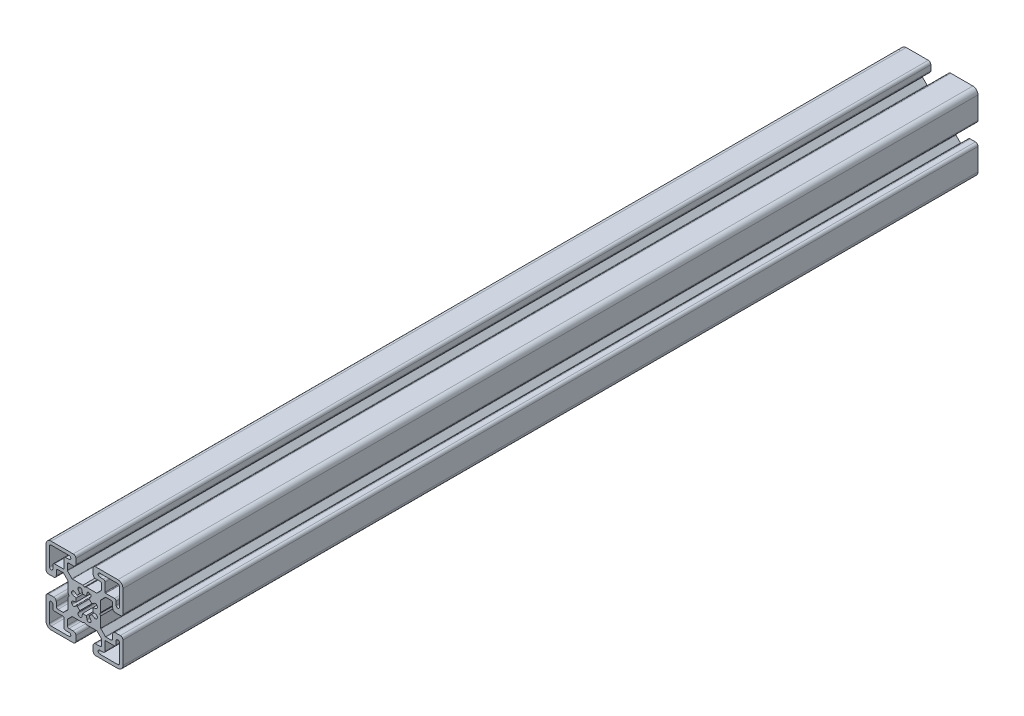
from build123d import *

# Parameters (mm, degrees)
EXTRUDE1_DEPTH = 500


with BuildPart() as part:
    # Sketch1 → Extrude1 (new body)
    with BuildSketch(Plane.XY):
        with BuildLine():
            Line((2.070696762, -5.483119356), (2.970696689, -4.967971313))
            Line((2.970696689, -4.967971313), (3.870696615, -5.483119356))
            Line((3.870696615, -5.483119356), (10.022269564, -5.483119356))
            ThreePointArc((10.022269564, -5.483119356), (10.167689268, -5.512045134), (10.290970141, -5.59441878))
            Line((10.290970141, -5.59441878), (12.909397265, -8.212845904))
            ThreePointArc((12.909397265, -8.212845904), (12.991770911, -8.336126777), (13.020696689, -8.481546481))
            Line((13.020696689, -8.481546481), (13.020696689, -11.483119356))
            ThreePointArc((13.020696689, -11.483119356), (12.72780347, -12.190226138), (12.020696689, -12.483119356))
            Line((12.020696689, -12.483119356), (9.555696689, -12.483119356))
            ThreePointArc((9.555696689, -12.483119356), (8.480894381, -12.928317049), (8.035696689, -14.003119356))
            Line((8.035696689, -14.003119356), (8.035696689, -16.963119356))
            ThreePointArc((8.035696689, -16.963119356), (8.480894381, -18.037921664), (9.555696689, -18.483119356))
            Line((9.555696689, -18.483119356), (22.470696689, -18.483119356))
            ThreePointArc((22.470696689, -18.483119356), (24.592017032, -17.6044397), (25.470696689, -15.483119356))
            Line((25.470696689, -15.483119356), (25.470696689, -2.568119356))
            ThreePointArc((25.470696689, -2.568119356), (25.025498996, -1.493317049), (23.950696689, -1.048119356))
            Line((23.950696689, -1.048119356), (20.990696689, -1.048119356))
            ThreePointArc((20.990696689, -1.048119356), (19.915894381, -1.493317049), (19.470696689, -2.568119356))
            Line((19.470696689, -2.568119356), (19.470696689, -5.033119356))
            ThreePointArc((19.470696689, -5.033119356), (19.17780347, -5.740226138), (18.470696689, -6.033119356))
            Line((18.470696689, -6.033119356), (15.469123813, -6.033119356))
            ThreePointArc((15.469123813, -6.033119356), (15.323704109, -6.004193579), (15.200423236, -5.921819933))
            Line((15.200423236, -5.921819933), (12.581996112, -3.303392809))
            ThreePointArc((12.581996112, -3.303392809), (12.499622466, -3.180111936), (12.470696689, -3.034692232))
            Line((12.470696689, -3.034692232), (12.470696689, 3.116881008))
            Line((12.470696689, 3.116881008), (11.951083419, 4.016880644))
            Line((11.951083419, 4.016880644), (12.470696689, 4.916880279))
            Line((12.470696689, 4.916880279), (12.470696689, 11.068453519))
            ThreePointArc((12.470696689, 11.068453519), (12.499622466, 11.213873223), (12.581996112, 11.337154096))
            Line((12.581996112, 11.337154096), (15.200423236, 13.95558122))
            ThreePointArc((15.200423236, 13.95558122), (15.323704109, 14.037954866), (15.469123813, 14.066880644))
            Line((15.469123813, 14.066880644), (18.470696689, 14.066880644))
            ThreePointArc((18.470696689, 14.066880644), (19.17780347, 13.773987425), (19.470696689, 13.066880644))
            Line((19.470696689, 13.066880644), (19.470696689, 10.601880644))
            ThreePointArc((19.470696689, 10.601880644), (19.915894381, 9.527078336), (20.990696689, 9.081880644))
            Line((20.990696689, 9.081880644), (23.950696689, 9.081880644))
            ThreePointArc((23.950696689, 9.081880644), (25.025498996, 9.527078336), (25.470696689, 10.601880644))
            Line((25.470696689, 10.601880644), (25.470696689, 23.516880644))
            ThreePointArc((25.470696689, 23.516880644), (24.592017032, 25.638200987), (22.470696689, 26.516880644))
            Line((22.470696689, 26.516880644), (9.555696689, 26.516880644))
            ThreePointArc((9.555696689, 26.516880644), (8.480894381, 26.071682951), (8.035696689, 24.996880644))
            Line((8.035696689, 24.996880644), (8.035696689, 22.036880644))
            ThreePointArc((8.035696689, 22.036880644), (8.480894381, 20.962078336), (9.555696689, 20.516880644))
            Line((9.555696689, 20.516880644), (12.020696689, 20.516880644))
            ThreePointArc((12.020696689, 20.516880644), (12.72780347, 20.223987425), (13.020696689, 19.516880644))
            Line((13.020696689, 19.516880644), (13.020696689, 16.515307768))
            ThreePointArc((13.020696689, 16.515307768), (12.991770911, 16.369888064), (12.909397265, 16.246607191))
            Line((12.909397265, 16.246607191), (10.290970141, 13.628180067))
            ThreePointArc((10.290970141, 13.628180067), (10.167689268, 13.545806421), (10.022269564, 13.516880644))
            Line((10.022269564, 13.516880644), (3.870696615, 13.516880644))
            Line((3.870696615, 13.516880644), (2.970696689, 13.0017326))
            Line((2.970696689, 13.0017326), (2.070696762, 13.516880644))
            Line((2.070696762, 13.516880644), (-4.080876187, 13.516880644))
            ThreePointArc((-4.080876187, 13.516880644), (-4.226295891, 13.545806421), (-4.349576764, 13.628180067))
            Line((-4.349576764, 13.628180067), (-6.968003888, 16.246607191))
            ThreePointArc((-6.968003888, 16.246607191), (-7.050377534, 16.369888064), (-7.079303311, 16.515307768))
            Line((-7.079303311, 16.515307768), (-7.079303311, 19.516880644))
            ThreePointArc((-7.079303311, 19.516880644), (-6.786410093, 20.223987425), (-6.079303311, 20.516880644))
            Line((-6.079303311, 20.516880644), (-3.614303311, 20.516880644))
            ThreePointArc((-3.614303311, 20.516880644), (-2.539501004, 20.962078336), (-2.094303311, 22.036880644))
            Line((-2.094303311, 22.036880644), (-2.094303311, 24.996880644))
            ThreePointArc((-2.094303311, 24.996880644), (-2.539501004, 26.071682951), (-3.614303311, 26.516880644))
            Line((-3.614303311, 26.516880644), (-16.529303311, 26.516880644))
            ThreePointArc((-16.529303311, 26.516880644), (-18.650623655, 25.638200987), (-19.529303311, 23.516880644))
            Line((-19.529303311, 23.516880644), (-19.529303311, 10.601880644))
            ThreePointArc((-19.529303311, 10.601880644), (-19.084105619, 9.527078336), (-18.009303311, 9.081880644))
            Line((-18.009303311, 9.081880644), (-15.049303311, 9.081880644))
            ThreePointArc((-15.049303311, 9.081880644), (-13.974501004, 9.527078336), (-13.529303311, 10.601880644))
            Line((-13.529303311, 10.601880644), (-13.529303311, 13.066880644))
            ThreePointArc((-13.529303311, 13.066880644), (-13.236410093, 13.773987425), (-12.529303311, 14.066880644))
            Line((-12.529303311, 14.066880644), (-9.527730436, 14.066880644))
            ThreePointArc((-9.527730436, 14.066880644), (-9.382310732, 14.037954866), (-9.259029859, 13.95558122))
            Line((-9.259029859, 13.95558122), (-6.640602735, 11.337154096))
            ThreePointArc((-6.640602735, 11.337154096), (-6.558229089, 11.213873223), (-6.529303311, 11.068453519))
            Line((-6.529303311, 11.068453519), (-6.529303311, 4.916880279))
            Line((-6.529303311, 4.916880279), (-6.009690042, 4.016880644))
            Line((-6.009690042, 4.016880644), (-6.529303311, 3.116881008))
            Line((-6.529303311, 3.116881008), (-6.529303311, -3.034692232))
            ThreePointArc((-6.529303311, -3.034692232), (-6.558229089, -3.180111936), (-6.640602735, -3.303392809))
            Line((-6.640602735, -3.303392809), (-9.259029859, -5.921819933))
            ThreePointArc((-9.259029859, -5.921819933), (-9.382310732, -6.004193579), (-9.527730436, -6.033119356))
            Line((-9.527730436, -6.033119356), (-12.529303311, -6.033119356))
            ThreePointArc((-12.529303311, -6.033119356), (-13.236410093, -5.740226138), (-13.529303311, -5.033119356))
            Line((-13.529303311, -5.033119356), (-13.529303311, -2.568119356))
            ThreePointArc((-13.529303311, -2.568119356), (-13.974501004, -1.493317049), (-15.049303311, -1.048119356))
            Line((-15.049303311, -1.048119356), (-18.009303311, -1.048119356))
            ThreePointArc((-18.009303311, -1.048119356), (-19.084105619, -1.493317049), (-19.529303311, -2.568119356))
            Line((-19.529303311, -2.568119356), (-19.529303311, -15.483119356))
            ThreePointArc((-19.529303311, -15.483119356), (-18.650623655, -17.6044397), (-16.529303311, -18.483119356))
            Line((-16.529303311, -18.483119356), (-3.614303311, -18.483119356))
            ThreePointArc((-3.614303311, -18.483119356), (-2.539501004, -18.037921664), (-2.094303311, -16.963119356))
            Line((-2.094303311, -16.963119356), (-2.094303311, -14.003119356))
            ThreePointArc((-2.094303311, -14.003119356), (-2.539501004, -12.928317049), (-3.614303311, -12.483119356))
            Line((-3.614303311, -12.483119356), (-6.079303311, -12.483119356))
            ThreePointArc((-6.079303311, -12.483119356), (-6.786410093, -12.190226138), (-7.079303311, -11.483119356))
            Line((-7.079303311, -11.483119356), (-7.079303311, -8.481546481))
            ThreePointArc((-7.079303311, -8.481546481), (-7.050377534, -8.336126777), (-6.968003888, -8.212845904))
            Line((-6.968003888, -8.212845904), (-4.349576764, -5.59441878))
            ThreePointArc((-4.349576764, -5.59441878), (-4.226295891, -5.512045134), (-4.080876187, -5.483119356))
            Line((-4.080876187, -5.483119356), (2.070696762, -5.483119356))
        make_face()
        with BuildLine():
            Line((-8.029303311, -14.483119356), (-6.029303311, -14.483119356))
            ThreePointArc((-6.029303311, -14.483119356), (-5.029303311, -15.483119356), (-6.029303311, -16.483119356))
            Line((-6.029303311, -16.483119356), (-16.529303311, -16.483119356))
            ThreePointArc((-16.529303311, -16.483119356), (-17.236410093, -16.190226138), (-17.529303311, -15.483119356))
            Line((-17.529303311, -15.483119356), (-17.529303311, -4.983119356))
            ThreePointArc((-17.529303311, -4.983119356), (-16.529303311, -3.983119356), (-15.529303311, -4.983119356))
            Line((-15.529303311, -4.983119356), (-15.529303311, -6.983119356))
            ThreePointArc((-15.529303311, -6.983119356), (-15.236410093, -7.690226138), (-14.529303311, -7.983119356))
            Line((-14.529303311, -7.983119356), (-9.409303311, -7.983119356))
            ThreePointArc((-9.409303311, -7.983119356), (-9.140602735, -8.09441878), (-9.029303311, -8.363119356))
            Line((-9.029303311, -8.363119356), (-9.029303311, -13.483119356))
            ThreePointArc((-9.029303311, -13.483119356), (-8.736410093, -14.190226138), (-8.029303311, -14.483119356))
        make_face(mode=Mode.SUBTRACT)
        with BuildLine():
            Line((-15.529303311, 15.016880644), (-15.529303311, 13.016880644))
            ThreePointArc((-15.529303311, 13.016880644), (-16.529303311, 12.016880644), (-17.529303311, 13.016880644))
            Line((-17.529303311, 13.016880644), (-17.529303311, 23.516880644))
            ThreePointArc((-17.529303311, 23.516880644), (-17.236410093, 24.223987425), (-16.529303311, 24.516880644))
            Line((-16.529303311, 24.516880644), (-6.029303311, 24.516880644))
            ThreePointArc((-6.029303311, 24.516880644), (-5.029303311, 23.516880644), (-6.029303311, 22.516880644))
            Line((-6.029303311, 22.516880644), (-8.029303311, 22.516880644))
            ThreePointArc((-8.029303311, 22.516880644), (-8.736410093, 22.223987425), (-9.029303311, 21.516880644))
            Line((-9.029303311, 21.516880644), (-9.029303311, 16.396880644))
            ThreePointArc((-9.029303311, 16.396880644), (-9.140602735, 16.128180067), (-9.409303311, 16.016880644))
            Line((-9.409303311, 16.016880644), (-14.529303311, 16.016880644))
            ThreePointArc((-14.529303311, 16.016880644), (-15.236410093, 15.723987425), (-15.529303311, 15.016880644))
        make_face(mode=Mode.SUBTRACT)
        with BuildLine():
            Line((14.970696689, 16.396880644), (14.970696689, 21.516880644))
            ThreePointArc((14.970696689, 21.516880644), (14.67780347, 22.223987425), (13.970696689, 22.516880644))
            Line((13.970696689, 22.516880644), (11.970696689, 22.516880644))
            ThreePointArc((11.970696689, 22.516880644), (10.970696689, 23.516880644), (11.970696689, 24.516880644))
            Line((11.970696689, 24.516880644), (22.470696689, 24.516880644))
            ThreePointArc((22.470696689, 24.516880644), (23.17780347, 24.223987425), (23.470696689, 23.516880644))
            Line((23.470696689, 23.516880644), (23.470696689, 13.016880644))
            ThreePointArc((23.470696689, 13.016880644), (22.470696689, 12.016880644), (21.470696689, 13.016880644))
            Line((21.470696689, 13.016880644), (21.470696689, 15.016880644))
            ThreePointArc((21.470696689, 15.016880644), (21.17780347, 15.723987425), (20.470696689, 16.016880644))
            Line((20.470696689, 16.016880644), (15.350696689, 16.016880644))
            ThreePointArc((15.350696689, 16.016880644), (15.081996112, 16.128180067), (14.970696689, 16.396880644))
        make_face(mode=Mode.SUBTRACT)
        with BuildLine():
            Line((8.813667521, 0.293110828), (7.186693868, 1.328876219))
            ThreePointArc((7.186693868, 1.328876219), (6.506092102, 0.48120825), (5.658370816, -0.199327106))
            Line((5.658370816, -0.199327106), (6.694267562, -1.8260382))
            ThreePointArc((6.694267562, -1.8260382), (6.809058347, -2.648996527), (6.26221419, -3.274615262))
            ThreePointArc((6.26221419, -3.274615262), (6.032089534, -3.374186522), (5.798957452, -3.466497007))
            ThreePointArc((5.798957452, -3.466497007), (4.969968429, -3.410814072), (4.469198099, -2.747826542))
            Line((4.469198099, -2.747826542), (4.051150727, -0.864985708))
            ThreePointArc((4.051150727, -0.864985708), (2.970500834, -0.983119353), (1.889860199, -0.864901048))
            Line((1.889860199, -0.864901048), (1.472091367, -2.747649108))
            ThreePointArc((1.472091367, -2.747649108), (0.971341296, -3.410737864), (0.142284835, -3.466439902))
            ThreePointArc((0.142284835, -3.466439902), (-0.090845384, -3.37412471), (-0.32096803, -3.274548804))
            ThreePointArc((-0.32096803, -3.274548804), (-0.867778008, -2.648991264), (-0.753073127, -1.826090189))
            Line((-0.753073127, -1.826090189), (0.282692264, -0.199116535))
            ThreePointArc((0.282692264, -0.199116535), (-0.564975705, 0.48148523), (-1.245511061, 1.329206516))
            Line((-1.245511061, 1.329206516), (-2.872222155, 0.29330977))
            ThreePointArc((-2.872222155, 0.29330977), (-3.695180482, 0.178518985), (-4.320799217, 0.725363142))
            ThreePointArc((-4.320799217, 0.725363142), (-4.420370477, 0.955487798), (-4.512680962, 1.18861988))
            ThreePointArc((-4.512680962, 1.18861988), (-4.456998027, 2.017608903), (-3.794010497, 2.518379234))
            Line((-3.794010497, 2.518379234), (-1.911169663, 2.936426605))
            ThreePointArc((-1.911169663, 2.936426605), (-2.029303308, 4.017076498), (-1.911085003, 5.097717133))
            Line((-1.911085003, 5.097717133), (-3.793833063, 5.515485965))
            ThreePointArc((-3.793833063, 5.515485965), (-4.456921819, 6.016236036), (-4.512623857, 6.845292497))
            ThreePointArc((-4.512623857, 6.845292497), (-4.420308665, 7.078422716), (-4.320732759, 7.308545362))
            ThreePointArc((-4.320732759, 7.308545362), (-3.695175219, 7.85535534), (-2.872274144, 7.740650459))
            Line((-2.872274144, 7.740650459), (-1.24530049, 6.704885068))
            ThreePointArc((-1.24530049, 6.704885068), (-0.564698724, 7.552553037), (0.283022561, 8.233088393))
            Line((0.283022561, 8.233088393), (-0.752874185, 9.859799487))
            ThreePointArc((-0.752874185, 9.859799487), (-0.86766497, 10.682757814), (-0.320820813, 11.308376549))
            ThreePointArc((-0.320820813, 11.308376549), (-0.090696157, 11.407947809), (0.142435925, 11.500258294))
            ThreePointArc((0.142435925, 11.500258294), (0.971424948, 11.444575359), (1.472195279, 10.781587829))
            Line((1.472195279, 10.781587829), (1.89024265, 8.898746995))
            ThreePointArc((1.89024265, 8.898746995), (2.970892543, 9.01688064), (4.051533178, 8.898662335))
            Line((4.051533178, 8.898662335), (4.46930201, 10.781410395))
            ThreePointArc((4.46930201, 10.781410395), (4.970052081, 11.444499151), (5.799108542, 11.500201189))
            ThreePointArc((5.799108542, 11.500201189), (6.032238761, 11.407885997), (6.262361407, 11.308310091))
            ThreePointArc((6.262361407, 11.308310091), (6.809171385, 10.682752551), (6.694466504, 9.859851476))
            Line((6.694466504, 9.859851476), (5.658701113, 8.232877822))
            ThreePointArc((5.658701113, 8.232877822), (6.506369082, 7.552276057), (7.186904438, 6.704554771))
            Line((7.186904438, 6.704554771), (8.813615532, 7.740451517))
            ThreePointArc((8.813615532, 7.740451517), (9.636573859, 7.855242302), (10.262192594, 7.308398145))
            ThreePointArc((10.262192594, 7.308398145), (10.361763854, 7.078273489), (10.454074339, 6.845141407))
            ThreePointArc((10.454074339, 6.845141407), (10.398391404, 6.016152384), (9.735403874, 5.515382054))
            Line((9.735403874, 5.515382054), (7.85256304, 5.097334682))
            ThreePointArc((7.85256304, 5.097334682), (7.970696685, 4.016684789), (7.85247838, 2.936044154))
            Line((7.85247838, 2.936044154), (9.73522644, 2.518275322))
            ThreePointArc((9.73522644, 2.518275322), (10.398315196, 2.017525251), (10.454017234, 1.18846879))
            ThreePointArc((10.454017234, 1.18846879), (10.361702042, 0.955338571), (10.262126136, 0.725215925))
            ThreePointArc((10.262126136, 0.725215925), (9.636568596, 0.178405947), (8.813667521, 0.293110828))
        make_face(mode=Mode.SUBTRACT)
        with BuildLine():
            Line((21.470696689, -6.983119356), (21.470696689, -4.983119356))
            ThreePointArc((21.470696689, -4.983119356), (22.470696689, -3.983119356), (23.470696689, -4.983119356))
            Line((23.470696689, -4.983119356), (23.470696689, -15.483119356))
            ThreePointArc((23.470696689, -15.483119356), (23.17780347, -16.190226138), (22.470696689, -16.483119356))
            Line((22.470696689, -16.483119356), (11.970696689, -16.483119356))
            ThreePointArc((11.970696689, -16.483119356), (10.970696689, -15.483119356), (11.970696689, -14.483119356))
            Line((11.970696689, -14.483119356), (13.970696689, -14.483119356))
            ThreePointArc((13.970696689, -14.483119356), (14.67780347, -14.190226138), (14.970696689, -13.483119356))
            Line((14.970696689, -13.483119356), (14.970696689, -8.363119356))
            ThreePointArc((14.970696689, -8.363119356), (15.081996112, -8.09441878), (15.350696689, -7.983119356))
            Line((15.350696689, -7.983119356), (20.470696689, -7.983119356))
            ThreePointArc((20.470696689, -7.983119356), (21.17780347, -7.690226138), (21.470696689, -6.983119356))
        make_face(mode=Mode.SUBTRACT)
    extrude(amount=EXTRUDE1_DEPTH)


solid = part.part
